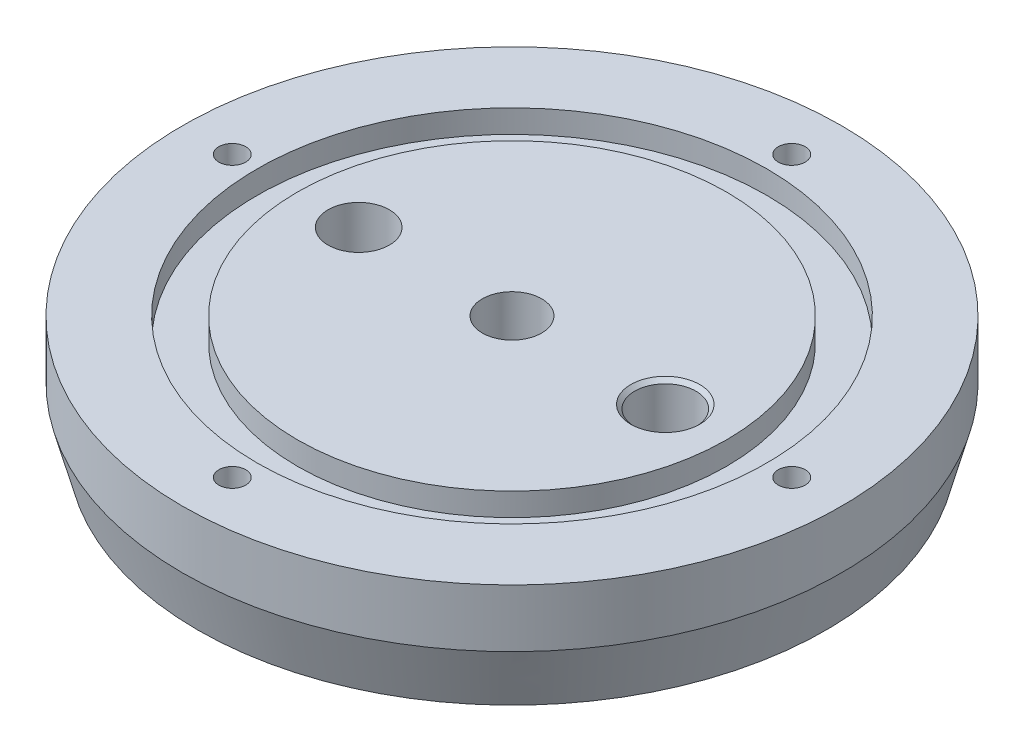
from build123d import *

# Parameters (mm, degrees)
SKETCH1_R           = 43
BOSS_EXTRUDE1_DEPTH = 15
SKETCH2_R           = 4
CUT_EXTRUDE1_DEPTH  = 63.633856659
SKETCH3_R           = 3.875
CUT_EXTRUDE2_DEPTH  = 63.633856659
SKETCH4_R           = 33.25
SKETCH4_R_2         = 28
CUT_EXTRUDE3_DEPTH  = 3
SKETCH5_R           = 1.75
CUT_EXTRUDE4_DEPTH  = 63.633856659
CIRPATTERN1_COUNT   = 4
CHAMFER1_SIZE       = 2
CHAMFER1_SIZE2      = 7.464101615
CHAMFER2_SIZE       = 0.5


with BuildPart() as part:
    # Sketch1 → Boss-Extrude1 (new body)
    with BuildSketch(Plane(origin=(0, 0, 0), x_dir=(1, 0, 0), z_dir=(0, 1, 0))):
        with Locations(Location((0, 0, 0), (0, 0, 270))):
            Circle(SKETCH1_R)
    extrude(amount=BOSS_EXTRUDE1_DEPTH)

    # Sketch2 → Cut-Extrude1 (cut, through all)
    with BuildSketch(Plane.XZ):
        with Locations(Location((20, 0, 0), (0, 0, 270))):
            Circle(SKETCH2_R)
        with Locations(Location((-20, 0, 0), (0, 0, 270))):
            Circle(SKETCH2_R)
    extrude(amount=-CUT_EXTRUDE1_DEPTH, mode=Mode.SUBTRACT)

    # Sketch3 → Cut-Extrude2 (cut, through all)
    with BuildSketch(Plane(origin=(0, 15, 0), x_dir=(1, 0, 0), z_dir=(0, 1, 0))):
        with Locations(Location((0, 0, 0), (0, 0, 270))):
            Circle(SKETCH3_R)
    extrude(amount=-CUT_EXTRUDE2_DEPTH, mode=Mode.SUBTRACT)

    # Sketch4 → Cut-Extrude3 (cut)
    with BuildSketch(Plane(origin=(0, 15, 0), x_dir=(1, 0, 0), z_dir=(0, 1, 0))):
        with Locations(Location((0, 0, 0), (0, 0, 270))):
            Circle(SKETCH4_R)
        with Locations(Location((0, 0, 0), (0, 0, 270))):
            Circle(SKETCH4_R_2, mode=Mode.SUBTRACT)
    extrude(amount=-CUT_EXTRUDE3_DEPTH, mode=Mode.SUBTRACT)

    # Sketch5 → Cut-Extrude4 (cut, through all)
    with BuildSketch(Plane.XZ):
        with Locations(Location((36.5, 0, 0), (0, 0, 270))):
            Circle(SKETCH5_R)
    cut_extrude4 = extrude(amount=-CUT_EXTRUDE4_DEPTH, mode=Mode.SUBTRACT)

    # CirPattern1: Cut-Extrude4 ×4 about axis
    cirpattern1_axis = Axis((0, 0, 0), (0, 1, 0))
    for i in range(1, CIRPATTERN1_COUNT):
        add(cut_extrude4.rotate(cirpattern1_axis, i * 360 / CIRPATTERN1_COUNT), mode=Mode.SUBTRACT)

    # Chamfer1
    chamfer1_edges = [part.edges().sort_by_distance(p)[0] for p in [
        (0, 0, -43),
    ]]
    chamfer1_side = [part.faces().sort_by_distance(p)[0] for p in [
        (0, 0, -41.783776336),
    ]]
    chamfer(chamfer1_edges, length=CHAMFER1_SIZE, length2=CHAMFER1_SIZE2, reference=chamfer1_side[0])

    # Chamfer2
    chamfer2_edges = [part.edges().sort_by_distance(p)[0] for p in [
        (-20, 0, 4),
        (0, 0, -3.875),
        (20, 15, 4),
        (20, 0, 4),
    ]]
    chamfer(chamfer2_edges, length=CHAMFER2_SIZE)


solid = part.part
